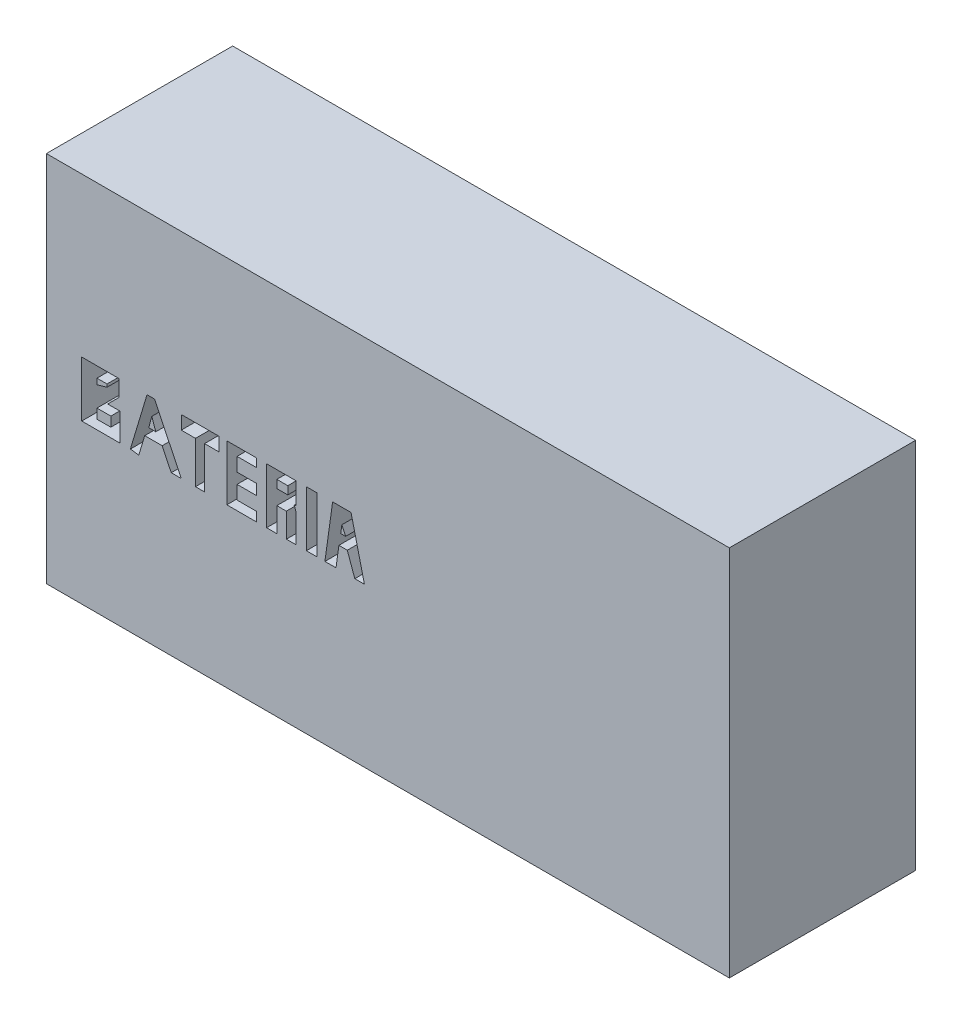
from build123d import *

# Parameters (mm, degrees)
ESBO_O1_W                = 55
ESBO_O1_H                = 30
RESSALTO_EXTRUS_O1_DEPTH = 15
ESBO_O2_W                = 1.117989905
ESBO_O2_H                = 0.777728151
ESBO_O2_W_2              = 0.882636654
ESBO_O2_H_2              = 0.645102453
ESBO_O2_W_3              = 0.853871188
ESBO_O2_H_3              = 4.4656048
CORTE_EXTRUS_O1_DEPTH    = 17


with BuildPart() as part:
    # Esboço1 → Ressalto-extrusão1 (new body)
    with BuildSketch(Plane.XY):
        with Locations((27.5, 15)):
            Rectangle(ESBO_O1_W, ESBO_O1_H)
    extrude(amount=RESSALTO_EXTRUS_O1_DEPTH)

    # Esboço2 → Corte-extrusão1 (cut)
    # profile 1 of 7: a face of its own
    with BuildSketch(Plane.XY.offset(15)):
        Polygon((2.846797453, 17.2328024), (2.846797453, 12.7671976), (5.945380375, 12.7671976), (5.945380375, 15), (4.935449534, 15), (5.846797453, 15.911347918), (5.846797453, 17.2328024), align=None)
        Polygon((4.071024043, 16.36960397), (4.071024043, 15.911347918), (4.879986722, 16.140475944), (4.879986722, 16.36960397), align=None, mode=Mode.SUBTRACT)
        with Locations((4.630018996, 13.895652484)):
            Rectangle(ESBO_O2_W, ESBO_O2_H, mode=Mode.SUBTRACT)
    # profile 2 of 7: a face of its own
    with BuildSketch(Plane.XY.offset(15)):
        with BuildLine():
            Line((6.760674797, 12.7671976), (8.104023421, 17.2328024))
            Line((8.104023421, 17.2328024), (8.71206543, 17.2328024))
            Line((8.71206543, 17.2328024), (10.861423229, 12.7671976))
            Line((10.861423229, 12.7671976), (10.055414055, 12.7671976))
            Line((10.055414055, 12.7671976), (9.325107303, 14.284516559))
            Line((9.325107303, 14.284516559), (7.920196767, 14.284516559))
            Line((7.920196767, 14.284516559), (7.432349109, 12.662796921))
            ThreePointArc((7.432349109, 12.662796921), (7.100119777, 12.73820863), (6.760674797, 12.7671976))
        make_face()
        Polygon((8.485817241, 15.911347918), (8.245428539, 15), (8.811049013, 15), align=None, mode=Mode.SUBTRACT)
    # profile 3 of 7: a face of its own
    with BuildSketch(Plane.XY.offset(15)):
        Polygon((10.861423229, 17.2328024), (10.861423229, 16.140475944), (12.006832655, 16.140475944), (12.006832655, 12.7671976), (12.740621995, 12.7671976), (12.740621995, 16.140475944), (13.887403005, 16.140475944), (13.887403005, 17.2328024), align=None)
    # profile 4 of 7: a face of its own
    with BuildSketch(Plane.XY.offset(15)):
        Polygon((14.531209888, 17.2328024), (14.531209888, 12.7671976), (16.905247768, 12.7671976), (16.905247768, 13.506788408), (15.356087456, 13.506788408), (15.356087456, 14.604910757), (16.905247768, 14.604910757), (16.905247768, 15.455673959), (15.356087456, 15.455673959), (15.356087456, 16.556450371), (16.905247768, 16.556450371), (16.905247768, 17.2328024), align=None)
    # profile 5 of 7: a face of its own
    with BuildSketch(Plane.XY.offset(15)):
        Polygon((17.732915234, 17.2328024), (17.732915234, 12.7671976), (18.558020956, 12.7671976), (18.558020956, 14.723064954), (19.32422063, 14.723064954), (19.32422063, 12.7671976), (20.119873327, 12.7671976), (20.119873327, 15), (19.957257441, 15.455673959), (20.119873327, 15.513706519), (20.119873327, 17.2328024), align=None)
        with Locations((18.999339283, 16.233899145)):
            Rectangle(ESBO_O2_W_2, ESBO_O2_H_2, mode=Mode.SUBTRACT)
    # profile 6 of 7: a face of its own
    with BuildSketch(Plane.XY.offset(15)):
        with Locations((21.361867782, 15)):
            Rectangle(ESBO_O2_W_3, ESBO_O2_H_3)
    # profile 7 of 7: a face of its own
    with BuildSketch(Plane.XY.offset(15)):
        Polygon((23.050203994, 17.2328024), (22.429206767, 12.7671976), (23.321890281, 12.7671976), (23.556438186, 14.453836772), (24.233979959, 14.453836772), (24.835889105, 12.7671976), (25.611817558, 12.7671976), (24.534934532, 17.2328024), align=None)
        Polygon((23.792569263, 16.006062165), (23.701128816, 15.348511883), (24.098136816, 15.348511883), align=None, mode=Mode.SUBTRACT)
    extrude(amount=-CORTE_EXTRUS_O1_DEPTH, mode=Mode.SUBTRACT)


with BuildPart() as corte_extrus_o1_piece_1:
    # of the separate pieces the step leaves, piece 1, a body of its own (corte_extrus_o1_pieces)
    add(part.part.solids().sort_by_distance((0, 0, 0))[0])


with BuildPart() as corte_extrus_o1_piece_2:
    # of the separate pieces the step leaves, piece 2, a body of its own (corte_extrus_o1_pieces)
    add(part.part.solids().sort_by_distance((5.189013948, 13.506788408, 0))[0])


with BuildPart() as corte_extrus_o1_piece_3:
    # of the separate pieces the step leaves, piece 3, a body of its own (corte_extrus_o1_pieces)
    add(part.part.solids().sort_by_distance((19.44065761, 15.911347918, 0))[0])


with BuildPart() as corte_extrus_o1_piece_4:
    # of the separate pieces the step leaves, piece 4, a body of its own (corte_extrus_o1_pieces)
    add(part.part.solids().sort_by_distance((4.879986722, 16.140475944, 0))[0])


with BuildPart() as corte_extrus_o1_piece_5:
    # of the separate pieces the step leaves, piece 5, a body of its own (corte_extrus_o1_pieces)
    add(part.part.solids().sort_by_distance((8.811049013, 15, 0))[0])


with BuildPart() as corte_extrus_o1_piece_6:
    # of the separate pieces the step leaves, piece 6, a body of its own (corte_extrus_o1_pieces)
    add(part.part.solids().sort_by_distance((23.701128816, 15.348511883, 0))[0])


solid = Compound([corte_extrus_o1_piece_1.part, corte_extrus_o1_piece_2.part, corte_extrus_o1_piece_3.part, corte_extrus_o1_piece_4.part, corte_extrus_o1_piece_5.part, corte_extrus_o1_piece_6.part])
